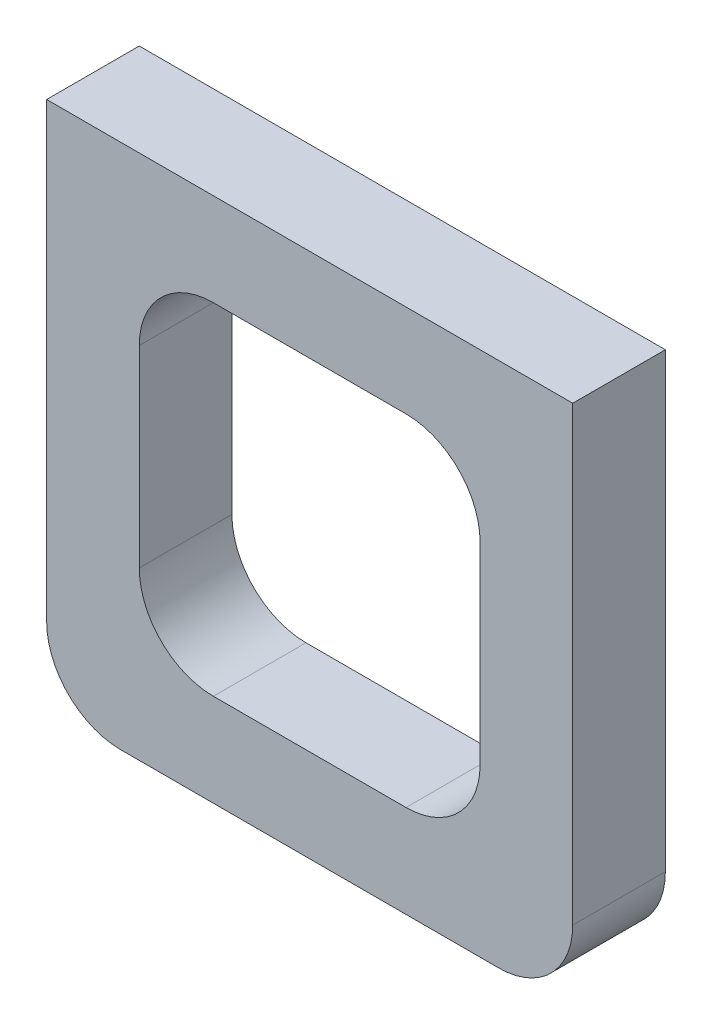
from build123d import *

# Parameters (mm, degrees)
BOSS_EXTRUDE1_DEPTH = 6.35


with BuildPart() as part:
    # Sketch1 → Boss-Extrude1 (new body)
    with BuildSketch(Plane.XY):
        with BuildLine():
            Line((0, 5.08), (0, 36.068))
            Line((0, 36.068), (36.068, 36.068))
            Line((36.068, 36.068), (36.068, 5.08))
            ThreePointArc((36.068, 5.08), (34.580102448, 1.487897552), (30.988, 0))
            Line((30.988, 0), (5.08, 0))
            ThreePointArc((5.08, 0), (1.487897552, 1.487897552), (0, 5.08))
        make_face()
        with BuildLine():
            Line((11.43, 6.35), (24.638, 6.35))
            ThreePointArc((24.638, 6.35), (28.230102448, 7.837897552), (29.718, 11.43))
            Line((29.718, 11.43), (29.718, 24.638))
            ThreePointArc((29.718, 24.638), (28.230102448, 28.230102448), (24.638, 29.718))
            Line((24.638, 29.718), (11.43, 29.718))
            ThreePointArc((11.43, 29.718), (7.837897552, 28.230102448), (6.35, 24.638))
            Line((6.35, 24.638), (6.35, 11.43))
            ThreePointArc((6.35, 11.43), (7.837897552, 7.837897552), (11.43, 6.35))
        make_face(mode=Mode.SUBTRACT)
    extrude(amount=BOSS_EXTRUDE1_DEPTH)


solid = part.part
